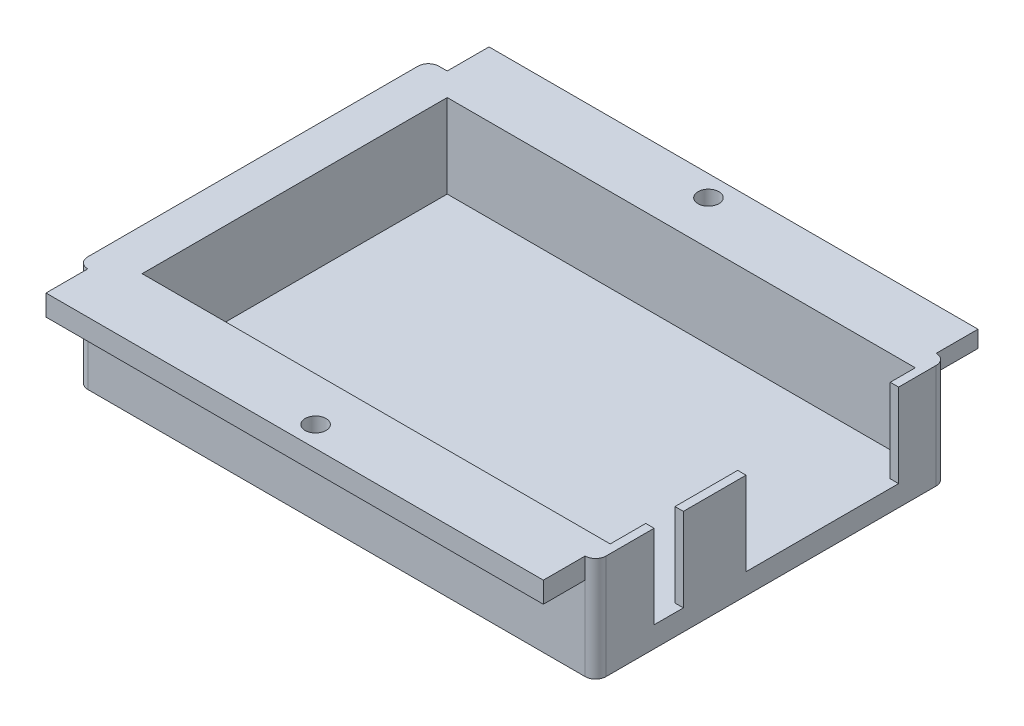
from build123d import *

# Parameters (mm, degrees)
SKETCH1_W           = 124
SKETCH1_H           = 84
BOSS_EXTRUDE1_DEPTH = 25
SKETCH2_W           = 112
SKETCH2_H           = 73
CUT_EXTRUDE1_DEPTH  = 20
SKETCH4_W           = 2
SKETCH4_H           = 7
SKETCH4_H_2         = 36.5
CUT_EXTRUDE2_DEPTH  = 20
FILLET1_R           = 2.5
SKETCH5_W           = 119
SKETCH5_H           = 5
BOSS_EXTRUDE2_DEPTH = 10
SKETCH6_W           = 117
SKETCH6_H           = 4
BOSS_EXTRUDE3_DEPTH = 10
SKETCH7_R           = 2.5
CUT_EXTRUDE3_DEPTH  = 85.693565281


with BuildPart() as part:
    # Sketch1 → Boss-Extrude1 (new body)
    with BuildSketch(Plane(origin=(0, 0, 0), x_dir=(1, 0, 0), z_dir=(0, 1, 0))):
        Rectangle(SKETCH1_W, SKETCH1_H)
    extrude(amount=BOSS_EXTRUDE1_DEPTH)

    # Sketch2 → Cut-Extrude1 (cut)
    with BuildSketch(Plane(origin=(0, 25, 0), x_dir=(1, 0, 0), z_dir=(0, 1, 0))):
        with Locations((4, 0)):
            Rectangle(SKETCH2_W, SKETCH2_H)
    extrude(amount=-CUT_EXTRUDE1_DEPTH, mode=Mode.SUBTRACT)

    # Sketch4 → Cut-Extrude2 (cut)
    with BuildSketch(Plane(origin=(0, 25, 0), x_dir=(1, 0, 0), z_dir=(0, 1, 0))):
        with Locations((61, -24.5)):
            Rectangle(SKETCH4_W, SKETCH4_H)
        with Locations((61, 12.25)):
            Rectangle(SKETCH4_W, SKETCH4_H_2)
    extrude(amount=-CUT_EXTRUDE2_DEPTH, mode=Mode.SUBTRACT)

    # Fillet1
    fillet1_edges = [part.edges().sort_by_distance(p)[0] for p in [
        (62, 12.5, 42),
        (-62, 12.5, 42),
        (-62, 12.5, -42),
        (62, 12.5, -42),
    ]]
    fillet(fillet1_edges, radius=FILLET1_R)

    # Sketch5 → Boss-Extrude2 (add)
    with BuildSketch(Plane.XY.offset(42)):
        with Locations((0, 22.5)):
            Rectangle(SKETCH5_W, SKETCH5_H)
    extrude(amount=BOSS_EXTRUDE2_DEPTH)

    # Sketch6 → Boss-Extrude3 (add)
    with BuildSketch(Plane(origin=(0, 0, -42), x_dir=(-1, 0, 0), z_dir=(0, 0, -1))):
        with Locations((-1, 23)):
            Rectangle(SKETCH6_W, SKETCH6_H)
    extrude(amount=BOSS_EXTRUDE3_DEPTH)

    # Sketch7 → Cut-Extrude3 (cut, through all)
    with BuildSketch(Plane(origin=(0, 25, 0), x_dir=(1, 0, 0), z_dir=(0, 1, 0))):
        with Locations(Location((0, 47, 0), (0, 0, 270))):
            Circle(SKETCH7_R)
        with Locations(Location((0, -47, 0), (0, 0, 270))):
            Circle(SKETCH7_R)
    extrude(amount=-CUT_EXTRUDE3_DEPTH, mode=Mode.SUBTRACT)


solid = part.part
